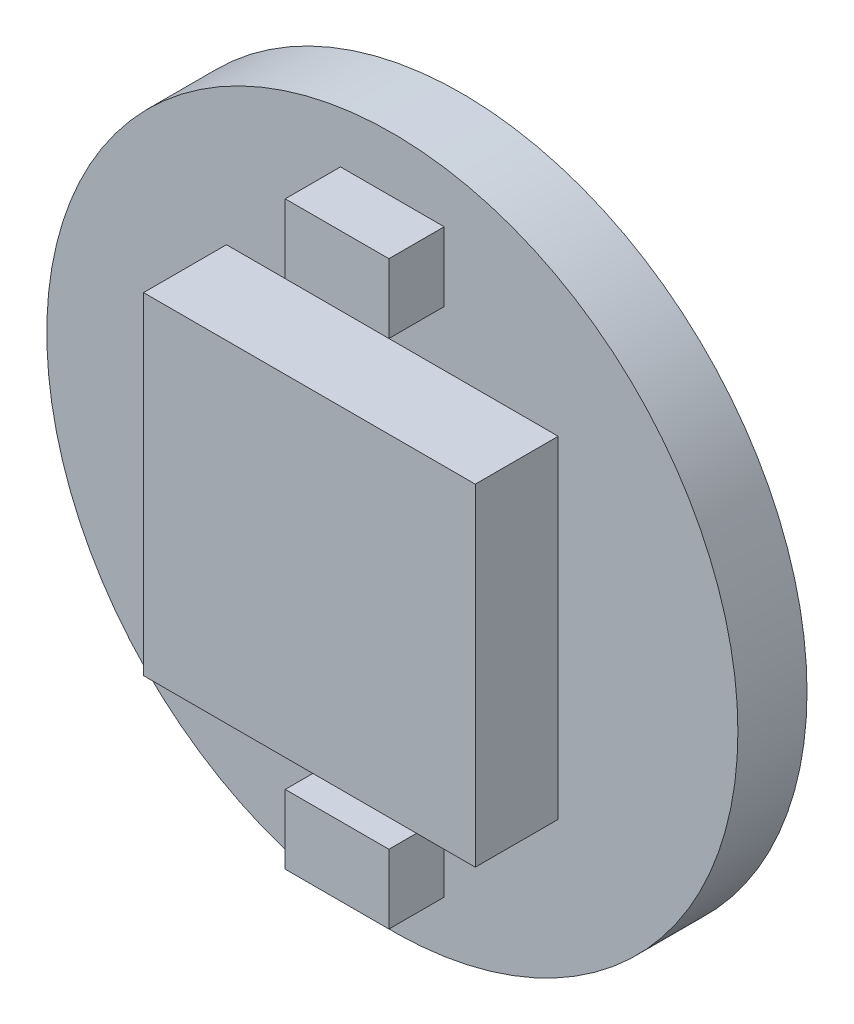
from build123d import *

# Parameters (mm, degrees)
SKETCH1_R           = 5
BOSS_EXTRUDE1_DEPTH = 1
SKETCH2_W           = 4.8
SKETCH2_H           = 4.8
BOSS_EXTRUDE2_DEPTH = 1.2
SKETCH3_W           = 1.5
SKETCH3_H           = 1
SKETCH3_W_2         = 0.75
BOSS_EXTRUDE3_DEPTH = 0.8


with BuildPart() as part:
    # Sketch1 → Boss-Extrude1 (new body)
    with BuildSketch(Plane.XY):
        Circle(SKETCH1_R)
    extrude(amount=BOSS_EXTRUDE1_DEPTH)

    # Sketch2 → Boss-Extrude2 (add)
    with BuildSketch(Plane.XY.offset(1)):
        Rectangle(SKETCH2_W, SKETCH2_H)
    extrude(amount=BOSS_EXTRUDE2_DEPTH)

    # Sketch3 → Boss-Extrude3 (add)
    with BuildSketch(Plane.XY.offset(1)):
        with Locations((0, -3.7)):
            Rectangle(SKETCH3_W, SKETCH3_H)
        with Locations((0.375, 3.7)):
            Rectangle(SKETCH3_W_2, SKETCH3_H)
        with Locations((-0.375, 3.7)):
            Rectangle(SKETCH3_W_2, SKETCH3_H)
    extrude(amount=BOSS_EXTRUDE3_DEPTH)


solid = part.part
